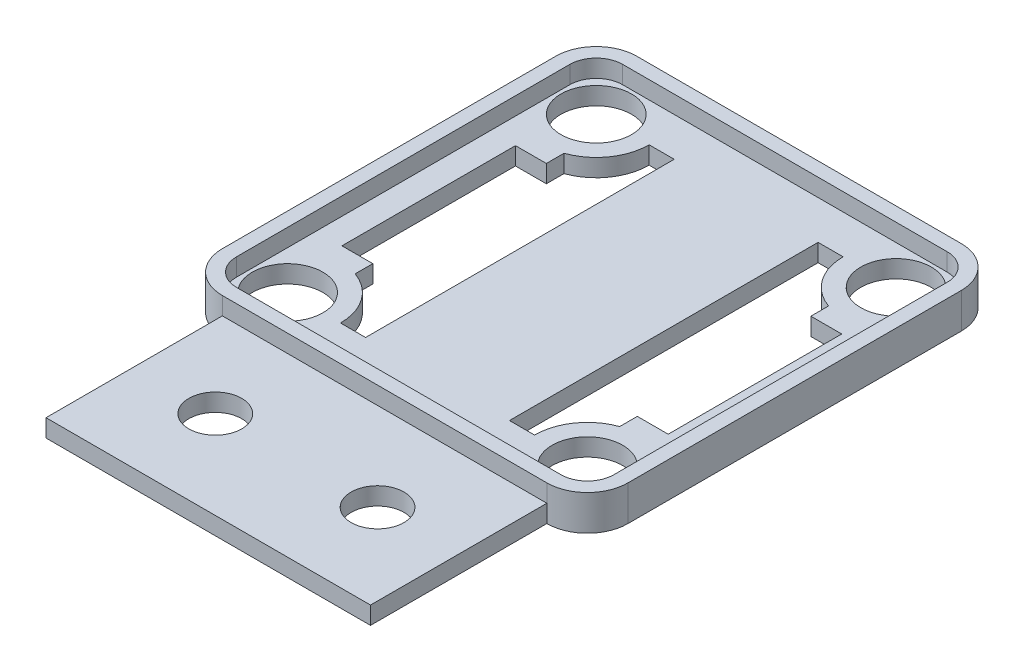
from build123d import *

# Parameters (mm, degrees)
BOSS_EXTRUDE1_DEPTH = 2
CUT_EXTRUDE2_DEPTH  = 1
SKETCH5_R           = 2
CUT_EXTRUDE3_DEPTH  = 21.942838525
CUT_EXTRUDE4_DEPTH  = 21.942838525
SKETCH7_W           = 18.4
SKETCH7_H           = 1
BOSS_EXTRUDE2_DEPTH = 10
SKETCH8_R           = 1.5
CUT_EXTRUDE5_DEPTH  = 25.092211634
CUT_EXTRUDE6_DEPTH  = 1
SKETCH11_W          = 1.421057218
SKETCH11_H          = 17.5
SKETCH11_W_2        = 1.75
SKETCH11_H_2        = 9.84
CUT_EXTRUDE7_DEPTH  = 25.092211634


with BuildPart() as part:
    # Sketch1 → Boss-Extrude1 (new body)
    with BuildSketch(Plane(origin=(0, 0, 0), x_dir=(1, 0, 0), z_dir=(0, 1, 0))):
        with BuildLine():
            Line((-12.649074074, 14.633101852), (5.750925926, 14.633101852))
            ThreePointArc((5.750925926, 14.633101852), (7.377271523, 13.959447449), (8.050925926, 12.333101852))
            Line((8.050925926, 12.333101852), (8.050925926, -6.566898148))
            ThreePointArc((8.050925926, -6.566898148), (7.377271523, -8.193243745), (5.750925926, -8.866898148))
            Line((5.750925926, -8.866898148), (-12.649074074, -8.866898148))
            ThreePointArc((-12.649074074, -8.866898148), (-14.275419671, -8.193243745), (-14.949074074, -6.566898148))
            Line((-14.949074074, -6.566898148), (-14.949074074, 12.333101852))
            ThreePointArc((-14.949074074, 12.333101852), (-14.275419671, 13.959447449), (-12.649074074, 14.633101852))
        make_face()
    extrude(amount=BOSS_EXTRUDE1_DEPTH)

    # Sketch2 → Cut-Extrude2 (cut)
    with BuildSketch(Plane(origin=(0, 2, 0), x_dir=(1, 0, 0), z_dir=(0, 1, 0))):
        with BuildLine():
            Line((5.750925926, 13.633101852), (-12.649074074, 13.633101852))
            ThreePointArc((-12.649074074, 13.633101852), (-13.56831289, 13.252340667), (-13.949074074, 12.333101852))
            Line((-13.949074074, 12.333101852), (-13.949074074, -6.566898148))
            ThreePointArc((-13.949074074, -6.566898148), (-13.56831289, -7.486136964), (-12.649074074, -7.866898148))
            Line((-12.649074074, -7.866898148), (5.750925926, -7.866898148))
            ThreePointArc((5.750925926, -7.866898148), (6.670164741, -7.486136964), (7.050925926, -6.566898148))
            Line((7.050925926, -6.566898148), (7.050925926, 12.333101852))
            ThreePointArc((7.050925926, 12.333101852), (6.670164741, 13.252340667), (5.750925926, 13.633101852))
        make_face()
    extrude(amount=-CUT_EXTRUDE2_DEPTH, mode=Mode.SUBTRACT)

    # Sketch5 → Cut-Extrude3 (cut, through all)
    with BuildSketch(Plane(origin=(0, 1, 0), x_dir=(1, 0, 0), z_dir=(0, 1, 0))):
        with Locations(Location((5.050925926, 11.633101852, 0), (0, 0, 270))):
            Circle(SKETCH5_R)
        with Locations(Location((5.050925926, -5.866898148, 0), (0, 0, 270))):
            Circle(SKETCH5_R)
        with Locations(Location((-11.949074074, -5.866898148, 0), (0, 0, 270))):
            Circle(SKETCH5_R)
        with Locations(Location((-11.949074074, 11.633101852, 0), (0, 0, 90))):
            Circle(SKETCH5_R)
    extrude(amount=-CUT_EXTRUDE3_DEPTH, mode=Mode.SUBTRACT)

    # Sketch6 → Cut-Extrude4 (cut, through all)
    with BuildSketch(Plane(origin=(0, 1, 0), x_dir=(1, 0, 0), z_dir=(0, 1, 0))):
        with BuildLine():
            Line((4.050925926, -3.038471023), (4.050925926, 8.804674727))
            ThreePointArc((4.050925926, 8.804674727), (2.601436183, 9.901051044), (2.050925926, 11.633101852))
            Line((2.050925926, 11.633101852), (2.050925926, -5.866898148))
            ThreePointArc((2.050925926, -5.866898148), (2.601436183, -4.134847341), (4.050925926, -3.038471023))
        make_face()
        with BuildLine():
            Line((-10.949074074, 8.804674727), (-10.949074074, -3.038471023))
            ThreePointArc((-10.949074074, -3.038471023), (-9.499584331, -4.134847341), (-8.949074074, -5.866898148))
            Line((-8.949074074, -5.866898148), (-8.949074074, 11.633101852))
            ThreePointArc((-8.949074074, 11.633101852), (-9.499584331, 9.901051044), (-10.949074074, 8.804674727))
        make_face()
    extrude(amount=-CUT_EXTRUDE4_DEPTH, mode=Mode.SUBTRACT)

    # Sketch7 → Boss-Extrude2 (add)
    with BuildSketch(Plane.XY.offset(8.866898148)):
        with Locations((-3.449074074, 0.5)):
            Rectangle(SKETCH7_W, SKETCH7_H)
    extrude(amount=BOSS_EXTRUDE2_DEPTH)

    # Sketch8 → Cut-Extrude5 (cut, through all)
    with BuildSketch(Plane(origin=(0, 1, 0), x_dir=(1, 0, 0), z_dir=(0, 1, 0))):
        with Locations(Location((1.150925926, -13.866898148, 0), (0, 0, 270))):
            Circle(SKETCH8_R)
        with Locations(Location((-8.049074074, -13.866898148, 0), (0, 0, 270))):
            Circle(SKETCH8_R)
    extrude(amount=-CUT_EXTRUDE5_DEPTH, mode=Mode.SUBTRACT)

    # Sketch9 → Cut-Extrude6 (cut)
    with BuildSketch(Plane(origin=(0, 2, 0), x_dir=(1, 0, 0), z_dir=(0, 1, 0))):
        with BuildLine():
            Line((5.750925926, 13.833101852), (-12.649074074, 13.833101852))
            ThreePointArc((-12.649074074, 13.833101852), (-13.709734246, 13.393762024), (-14.149074074, 12.333101852))
            Line((-14.149074074, 12.333101852), (-14.149074074, -6.566898148))
            ThreePointArc((-14.149074074, -6.566898148), (-13.709734246, -7.62755832), (-12.649074074, -8.066898148))
            Line((-12.649074074, -8.066898148), (5.750925926, -8.066898148))
            ThreePointArc((5.750925926, -8.066898148), (6.811586098, -7.62755832), (7.250925926, -6.566898148))
            Line((7.250925926, -6.566898148), (7.250925926, 12.333101852))
            ThreePointArc((7.250925926, 12.333101852), (6.811586098, 13.393762024), (5.750925926, 13.833101852))
        make_face()
    extrude(amount=-CUT_EXTRUDE6_DEPTH, mode=Mode.SUBTRACT)

    # Sketch11 → Cut-Extrude7 (cut, through all)
    with BuildSketch(Plane(origin=(0, 1, 0), x_dir=(1, 0, 0), z_dir=(0, 1, 0))):
        with Locations((-8.238545465, 2.883101852)):
            Rectangle(SKETCH11_W, SKETCH11_H)
        with Locations((1.340397317, 2.883101852)):
            Rectangle(SKETCH11_W, SKETCH11_H)
        with Locations((-11.824074074, 2.883101852)):
            Rectangle(SKETCH11_W_2, SKETCH11_H_2)
        with Locations((4.925925926, 2.883101852)):
            Rectangle(SKETCH11_W_2, SKETCH11_H_2)
    extrude(amount=-CUT_EXTRUDE7_DEPTH, mode=Mode.SUBTRACT)


solid = part.part
